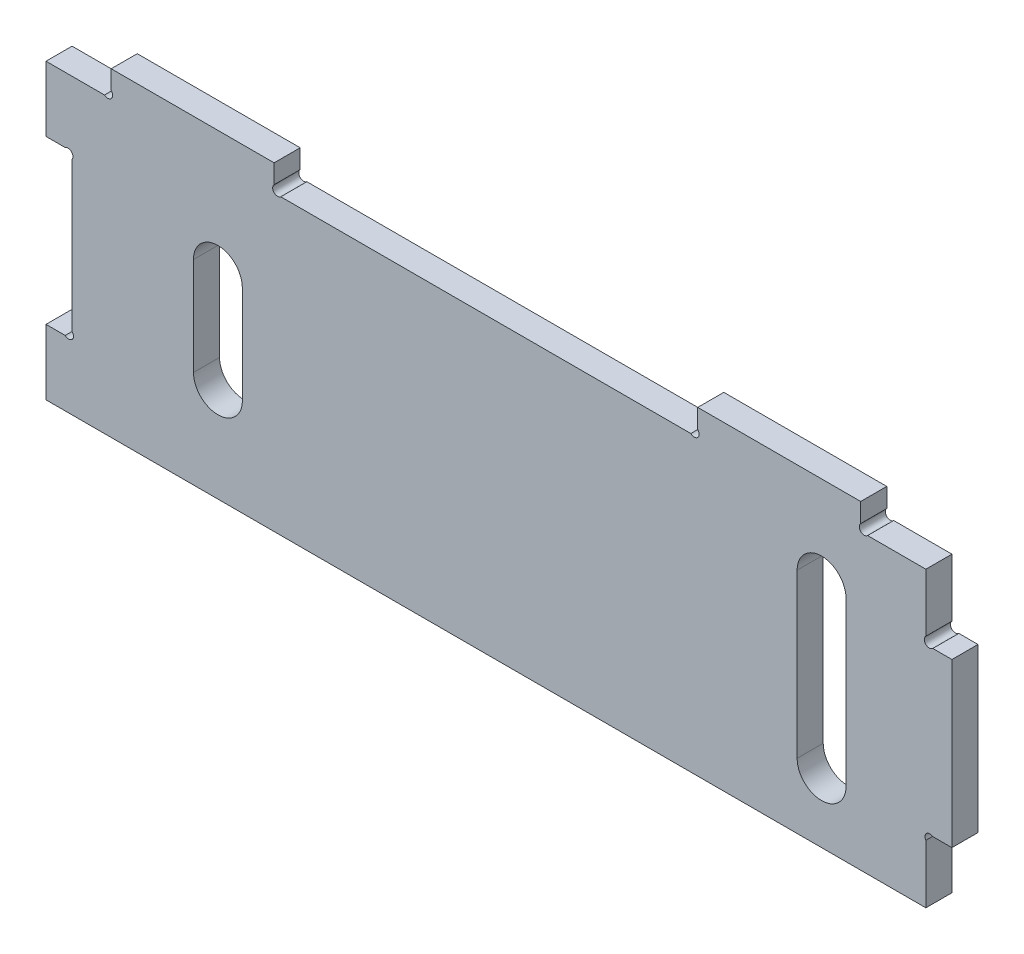
from build123d import *

# Parameters (mm, degrees)
BOSS_EXTRU_1_DEPTH      = 8
ENL_V_MAT_EXTRU_1_DEPTH = 8


with BuildPart() as part:
    # Esquisse1 → Boss.-Extru.1 (new body)
    with BuildSketch(Plane.XY):
        with BuildLine():
            Line((30.121320344, 221.336361724), (36, 221.336361724))
            Line((36, 221.336361724), (36, 171.336361724))
            Line((36, 171.336361724), (30.121320344, 171.336361724))
            ThreePointArc((30.121320344, 171.336361724), (28.201672528, 171.196524964), (28, 169.282385406))
            Line((28, 169.282385406), (28, 151.336361724))
            Line((28, 151.336361724), (-242, 151.336361724))
            Line((-242, 151.336361724), (-242, 171.40370575))
            Line((-242, 171.40370575), (-236.121320344, 171.40370575))
            ThreePointArc((-236.121320344, 171.40370575), (-234, 171.40370575), (-234, 173.525026093))
            Line((-234, 173.525026093), (-234, 219.282385406))
            ThreePointArc((-234, 219.282385406), (-234.201672528, 221.196524964), (-236.121320344, 221.336361724))
            Line((-236.121320344, 221.336361724), (-242, 221.336361724))
            Line((-242, 221.336361724), (-242, 241.336361724))
            Line((-242, 241.336361724), (-224.049400042, 241.336361724))
            ThreePointArc((-224.049400042, 241.336361724), (-221.965737315, 241.439112813), (-222, 243.525026093))
            Line((-222, 243.525026093), (-222, 249.336361724))
            Line((-222, 249.336361724), (-172, 249.336361724))
            Line((-172, 249.336361724), (-172, 243.525026093))
            ThreePointArc((-172, 243.525026093), (-172.034262685, 241.439112813), (-169.950599958, 241.336361724))
            Line((-169.950599958, 241.336361724), (-44.121320344, 241.336361724))
            ThreePointArc((-44.121320344, 241.336361724), (-42, 241.336361724), (-42, 243.457682068))
            Line((-42, 243.457682068), (-42, 249.336361724))
            Line((-42, 249.336361724), (8, 249.336361724))
            Line((8, 249.336361724), (8, 243.457682068))
            ThreePointArc((8, 243.457682068), (8, 241.336361724), (10.121320344, 241.336361724))
            Line((10.121320344, 241.336361724), (28, 241.336361724))
            Line((28, 241.336361724), (28, 223.525026093))
            ThreePointArc((28, 223.525026093), (27.966327987, 221.370033737), (30.121320344, 221.336361724))
        make_face()
    extrude(amount=BOSS_EXTRU_1_DEPTH)

    # Esquisse2 → Enlèv. mat.-Extru.1 (cut)
    with BuildSketch(Plane.XY.offset(8)):
        with BuildLine():
            Line((3.5, 221.336361724), (3.5, 171.336361724))
            ThreePointArc((3.5, 171.336361724), (-4, 163.836361724), (-11.5, 171.336361724))
            Line((-11.5, 171.336361724), (-11.5, 221.336361724))
            ThreePointArc((-11.5, 221.336361724), (-4, 228.836361724), (3.5, 221.336361724))
        make_face()
        with BuildLine():
            Line((-196.761984324, 211.248045222), (-196.738010886, 181.248045222))
            ThreePointArc((-196.738010886, 181.248045222), (-189.232019924, 173.754040975), (-181.738015676, 181.260031937))
            Line((-181.738015676, 181.260031937), (-181.761989114, 211.260031937))
            ThreePointArc((-181.761989114, 211.260031937), (-189.267980076, 218.754036185), (-196.761984324, 211.248045222))
        make_face()
    extrude(amount=-ENL_V_MAT_EXTRU_1_DEPTH, mode=Mode.SUBTRACT)


solid = part.part
